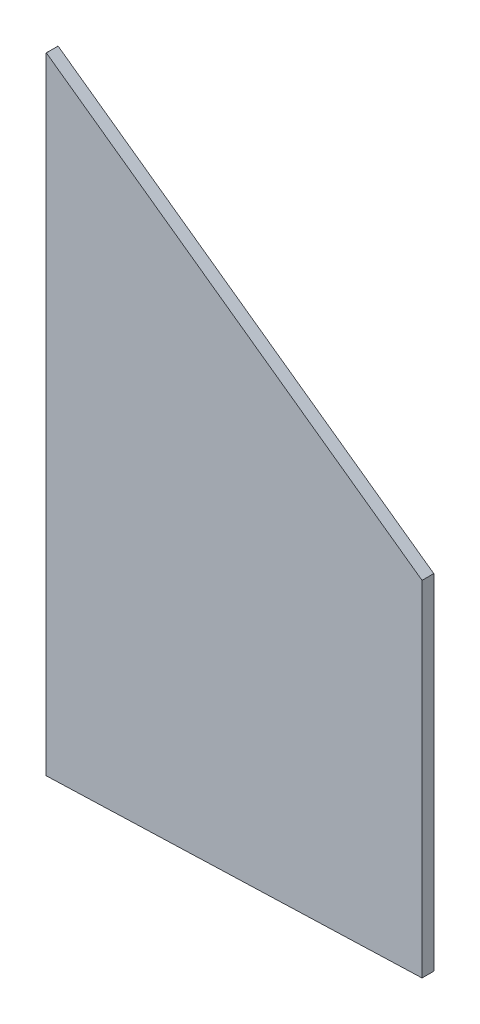
from build123d import *

# Parameters (mm, degrees)
BOSS_EXTRUDE1_DEPTH      = 2.38125
BOSS_EXTRUDE2_DEPTH      = 27
BOSS_EXTRUDE2_DEPTH_BACK = 227


with BuildPart() as part:
    # Sketch1 → Boss-Extrude1 (new, symmetric)
    with BuildSketch(Plane.XY):
        Polygon((0, -127), (0, 127), (152.4, 17.892316301), (152.4, -121.807683699), align=None)
    extrude(amount=BOSS_EXTRUDE1_DEPTH, both=True)

    # Sketch4 → Boss-Extrude2 (add, two sides: drawn at the far end of the back side and taken through both)
    with BuildSketch(Plane(origin=(0, 100, 0), x_dir=(1, 0, 0), z_dir=(0, 1, 0)).offset(-BOSS_EXTRUDE2_DEPTH_BACK)):
        with BuildLine():
            Line((0, -2.38125), (0, 0))
            ThreePointArc((0, 0), (-0.01389267, -1.190949078), (-0.055563118, -2.38125))
            Line((-0.055563118, -2.38125), (0, -2.38125))
        make_face()
        with BuildLine():
            Line((0, 0), (0, 2.38125))
            Line((0, 2.38125), (-0.055563118, 2.38125))
            ThreePointArc((-0.055563118, 2.38125), (-0.01389267, 1.190949078), (0, 0))
        make_face()
    extrude(amount=BOSS_EXTRUDE2_DEPTH + BOSS_EXTRUDE2_DEPTH_BACK)


solid = part.part
